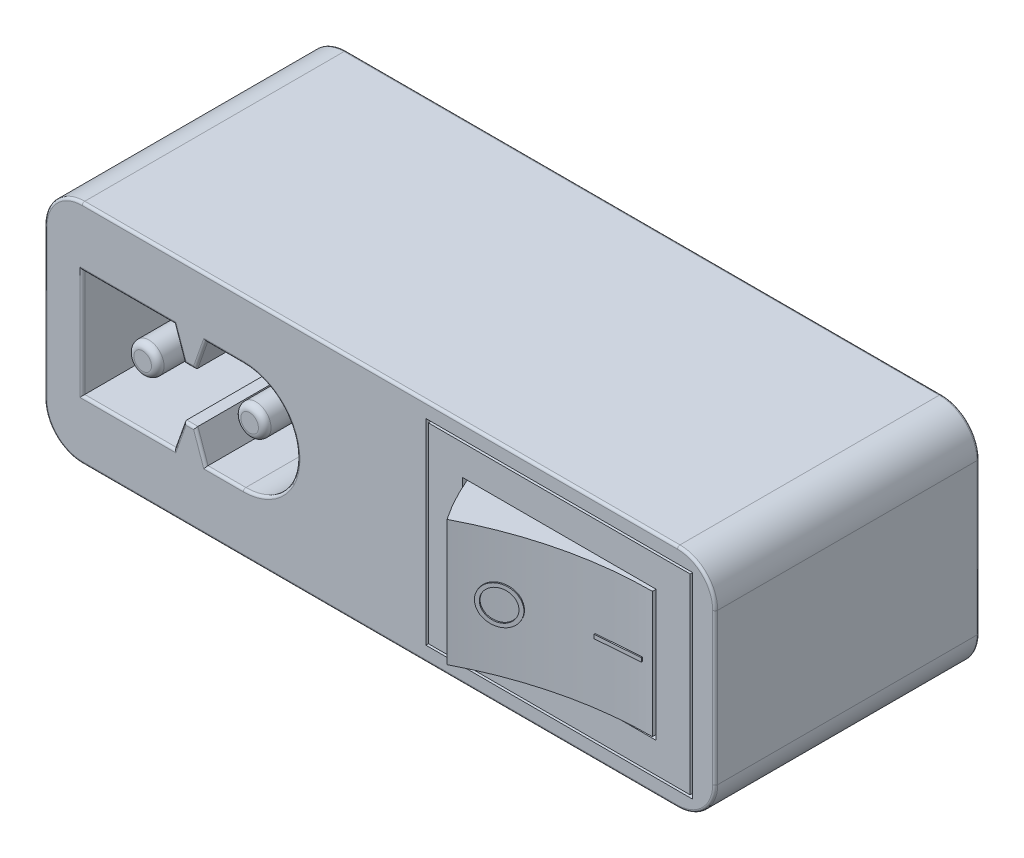
from build123d import *

# Parameters (mm, degrees)
EXTRUSION1_DEPTH        = 21
ENL_V_MAT_EXTRU_1_DEPTH = 10
ESQUISSE3_R             = 1.2
EXTRUSION2_DEPTH        = 9.5
CONG_1_R                = 0.5
CONG_2_R                = 0.2
ESQUISSE5_W             = 21.2
ESQUISSE5_H             = 15.6
ESQUISSE5_W_2           = 20.8
ESQUISSE5_H_2           = 15.2
ENL_V_MAT_EXTRU_2_DEPTH = 3
ESQUISSE6_W             = 15.4
ESQUISSE6_H             = 10.4
ENL_V_MAT_EXTRU_3_DEPTH = 3
EXTRUSION3_DEPTH        = 5
ESQUISSE8_R             = 1.5
ESQUISSE8_R_2           = 1.2
EXTRUSION4_DEPTH        = 0.1
ESQUISSE9_W             = 3.5
ESQUISSE9_H             = 0.3
EXTRUSION5_DEPTH        = 0.1
ESQUISSE10_R            = 3
ENL_V_MAT_EXTRU_4_DEPTH = 5
CONG_3_R                = 0.2
CONG_4_R                = 0.2


with BuildPart() as part:
    # Esquisse1 → Extrusion1 (new body)
    with BuildSketch(Plane.XY):
        with BuildLine():
            Line((-22.75, 9), (24.55, 9))
            ThreePointArc((24.55, 9), (26.671320344, 8.121320344), (27.55, 6))
            Line((27.55, 6), (27.55, -6))
            ThreePointArc((27.55, -6), (26.671320344, -8.121320344), (24.55, -9))
            Line((24.55, -9), (-22.75, -9))
            ThreePointArc((-22.75, -9), (-24.871320344, -8.121320344), (-25.75, -6))
            Line((-25.75, -6), (-25.75, 6))
            ThreePointArc((-25.75, 6), (-24.871320344, 8.121320344), (-22.75, 9))
        make_face()
    extrude(amount=-EXTRUSION1_DEPTH)

    # Esquisse2 → Enlèv. mat.-Extru.1 (cut)
    with BuildSketch(Plane.XY):
        with BuildLine():
            Line((-22.75, 4.3), (-15.454474502, 4.3))
            Line((-15.454474502, 4.3), (-14.643426738, 2))
            Line((-14.643426738, 2), (-13.756573262, 2))
            Line((-13.756573262, 2), (-12.95, 4.3))
            Line((-12.95, 4.3), (-9.95, 4.3))
            ThreePointArc((-9.95, 4.3), (-5.65, 0), (-9.95, -4.3))
            Line((-9.95, -4.3), (-12.95, -4.3))
            Line((-12.95, -4.3), (-13.756573262, -2))
            Line((-13.756573262, -2), (-14.643426738, -2))
            Line((-14.643426738, -2), (-15.454474502, -4.3))
            Line((-15.454474502, -4.3), (-22.75, -4.3))
            Line((-22.75, -4.3), (-22.75, 4.3))
        make_face()
    extrude(amount=-ENL_V_MAT_EXTRU_1_DEPTH, mode=Mode.SUBTRACT)

    # Esquisse3 → Extrusion2 (add)
    with BuildSketch(Plane.XY.offset(-10)):
        with Locations((-9.95, 0)):
            Circle(ESQUISSE3_R)
        with Locations((-18.45, 0)):
            Circle(ESQUISSE3_R)
    extrude(amount=EXTRUSION2_DEPTH)

    # Congé1
    cong_1_edges = [part.edges().sort_by_distance(p)[0] for p in [
        (-11.15, 0, -0.5),
        (-19.65, 0, -0.5),
    ]]
    fillet(cong_1_edges, radius=CONG_1_R)

    # Congé2
    cong_2_edges = [part.edges().sort_by_distance(p)[0] for p in [
        (-22.75, 0, 0),
        (-19.102237251, -4.3, 0),
        (-15.04895062, -3.15, 0),
        (-14.2, -2, 0),
        (-13.353286631, -3.15, 0),
        (-11.45, -4.3, 0),
        (-5.65, 0, 0),
        (-11.45, 4.3, 0),
        (-13.353286631, 3.15, 0),
        (-14.2, 2, 0),
        (-15.04895062, 3.15, 0),
        (-19.102237251, 4.3, 0),
    ]]
    fillet(cong_2_edges, radius=CONG_2_R)

    # Esquisse5 → Enlèv. mat.-Extru.2 (cut)
    with BuildSketch(Plane.XY):
        with Locations((15.15, 0)):
            Rectangle(ESQUISSE5_W, ESQUISSE5_H)
        with Locations((15.15, 0)):
            Rectangle(ESQUISSE5_W_2, ESQUISSE5_H_2, mode=Mode.SUBTRACT)
    extrude(amount=-ENL_V_MAT_EXTRU_2_DEPTH, mode=Mode.SUBTRACT)

    # Esquisse6 → Enlèv. mat.-Extru.3 (cut)
    with BuildSketch(Plane.XY):
        with Locations((15.15, 0)):
            Rectangle(ESQUISSE6_W, ESQUISSE6_H)
    extrude(amount=-ENL_V_MAT_EXTRU_3_DEPTH, mode=Mode.SUBTRACT)

    # Esquisse7 → Extrusion3 (add, symmetric)
    with BuildSketch(Plane(origin=(0, 0, 0), x_dir=(1, 0, 0), z_dir=(0, 1, 0))):
        with BuildLine():
            Line((7.65, 3), (7.65, 0.179778052))
            ThreePointArc((7.65, 0.179778052), (8.505861002, -1.607503561), (9.536554661, -3.3))
            ThreePointArc((9.536554661, -3.3), (15.899956373, -0.905809313), (22.65, -0.092211479))
            Line((22.65, -0.092211479), (22.65, 3))
            Line((22.65, 3), (7.65, 3))
        make_face()
    extrude(amount=EXTRUSION3_DEPTH, both=True)

    # Esquisse8 → Extrusion4 (add)
    with BuildSketch(Plane(origin=(2.642864241, 0, 6.226197974), x_dir=(0.9205048534524413, 0, -0.39073112848927166), z_dir=(0.39073112848927166, 0, 0.9205048534524413))):
        with Locations(Location((10.689032127, 0, 0), (0, 0, 33.617291892))):
            Circle(ESQUISSE8_R)
        with Locations((10.689032127, 0)):
            Circle(ESQUISSE8_R_2, mode=Mode.SUBTRACT)
    extrude(amount=EXTRUSION4_DEPTH)

    # Esquisse10 → Enlèv. mat.-Extru.4 (cut)
    with BuildSketch(Plane.XZ.offset(9)):
        with Locations(Location((0, -11, 0), (0, 0, 270))):
            Circle(ESQUISSE10_R)
    extrude(amount=-ENL_V_MAT_EXTRU_4_DEPTH, mode=Mode.SUBTRACT)

    # Congé3
    cong_3_edges = [part.edges().sort_by_distance(p)[0] for p in [
        (27.55, 0, 0),
        (26.671320344, -8.121320344, 0),
        (0.9, -9, 0),
        (-24.871320344, -8.121320344, 0),
        (-25.75, 0, 0),
        (-24.871320344, 8.121320344, 0),
        (0.9, 9, 0),
        (26.671320344, 8.121320344, 0),
    ]]
    fillet(cong_3_edges, radius=CONG_3_R)

    # Congé4
    cong_4_edges = [part.edges().sort_by_distance(p)[0] for p in [
        (26.671320344, 8.121320344, -21),
        (0.9, 9, -21),
        (-24.871320344, 8.121320344, -21),
        (-25.75, 0, -21),
        (-24.871320344, -8.121320344, -21),
        (0.9, -9, -21),
        (26.671320344, -8.121320344, -21),
        (27.55, 0, -21),
    ]]
    fillet(cong_4_edges, radius=CONG_4_R)


with BuildPart() as body_2:
    # Esquisse9 → Extrusion5 (new body)
    with BuildSketch(Plane(origin=(0.146642069, 0, 1.863264158), x_dir=(0.9969173337331282, 0, -0.07845909572784168), z_dir=(0.07845909572784168, 0, 0.9969173337331282))):
        with Locations((20.095779555, 0)):
            Rectangle(ESQUISSE9_W, ESQUISSE9_H)
    extrude(amount=EXTRUSION5_DEPTH)


solid = Compound([part.part, body_2.part])
